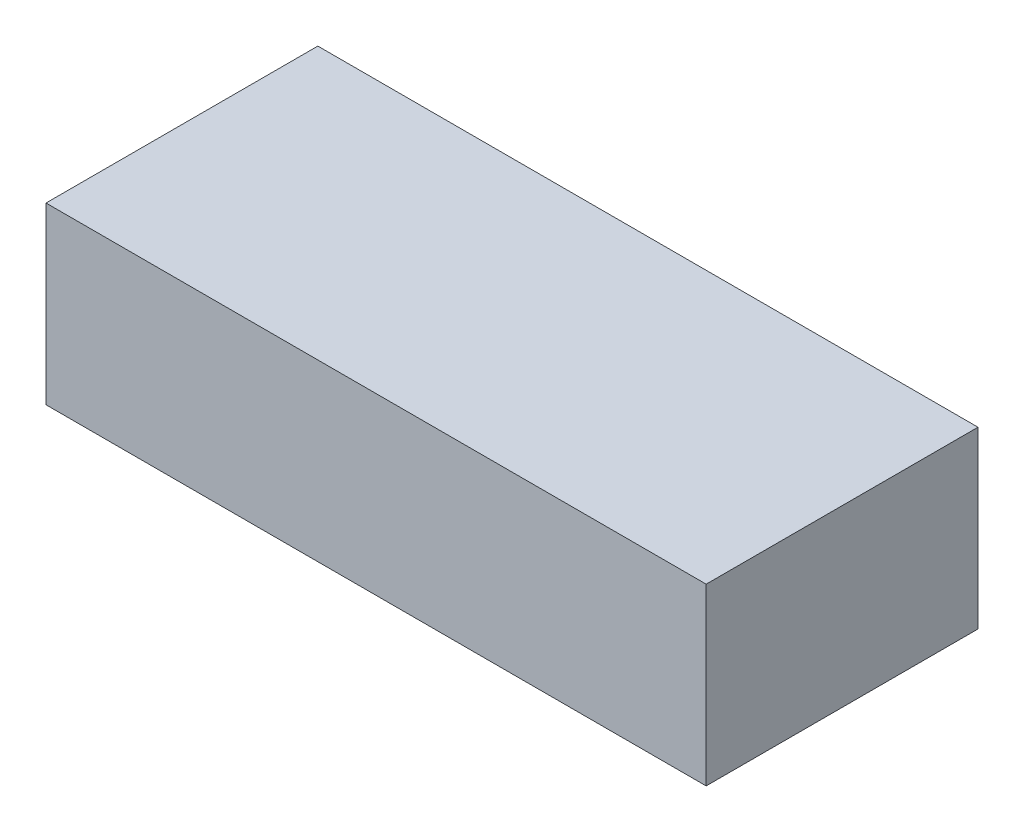
from build123d import *

# Parameters (mm, degrees)
SKETCH_1_W        = 170
SKETCH_1_H        = 70
EXTRUDE_337_DEPTH = 22.5


with BuildPart() as part:
    # ｽｹｯﾁ1 → Extrude 337 (new, symmetric)
    with BuildSketch(Plane(origin=(0, 0, 0), x_dir=(1, 0, 0), z_dir=(0, 1, 0))):
        Rectangle(SKETCH_1_W, SKETCH_1_H)
    extrude(amount=EXTRUDE_337_DEPTH, both=True)


solid = part.part
